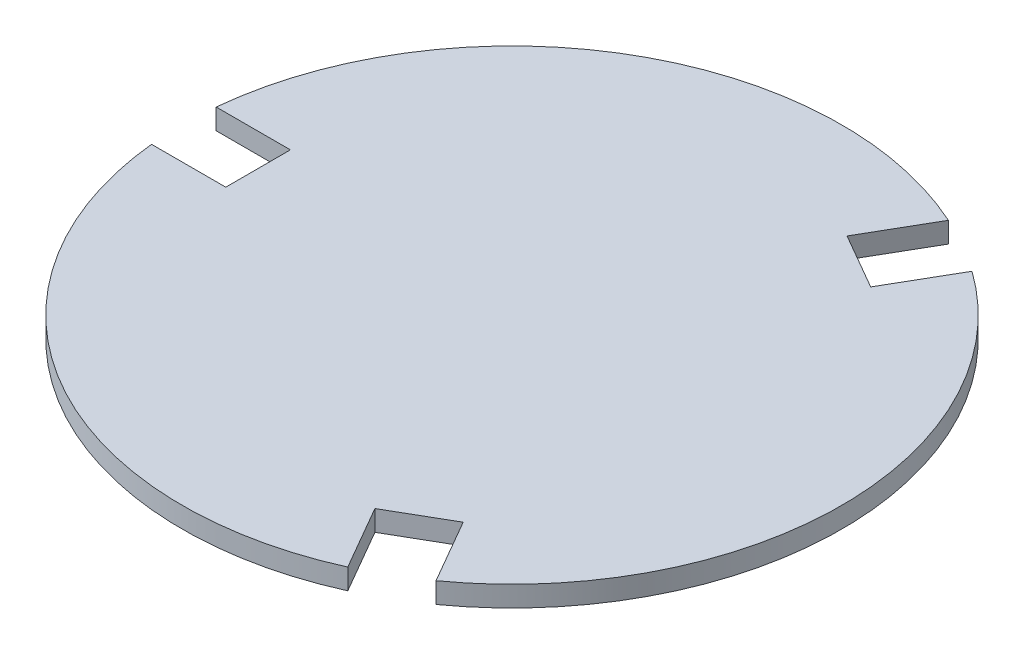
from build123d import *

# Parameters (mm, degrees)
SKETCH1_R         = 50.8
EXTRUDE1_DEPTH    = 3.175
EXTRUDE2_DEPTH    = 72.912172996
CIRPATTERN1_COUNT = 2
CIRPATTERN1_ANGLE = 120
CIRPATTERN2_COUNT = 2
CIRPATTERN2_ANGLE = 120


with BuildPart() as part:
    # Sketch1 → Extrude1 (new body)
    with BuildSketch(Plane(origin=(0, 0, 0), x_dir=(1, 0, 0), z_dir=(0, 1, 0))):
        with Locations(Location((0, 0, 0), (0, 0, 270))):
            Circle(SKETCH1_R)
    extrude(amount=EXTRUDE1_DEPTH)

    # Sketch3 → Extrude2 (cut, through all)
    with BuildSketch(Plane(origin=(0, 3.175, 0), x_dir=(-1, 0, 0), z_dir=(0, 1, 0))):
        Polygon((42.177913697, -4.9784), (39.125469867, -4.9784), (39.125469867, 4.9784), (42.300469867, 4.9784), (50.555469867, 4.9784), (52.750339101, 4.9784), (52.750339101, -4.9784), (50.555469867, -4.9784), align=None)
    extrude2 = extrude(amount=-EXTRUDE2_DEPTH, mode=Mode.SUBTRACT)

    # CirPattern1: Extrude2 ×2 about axis
    cirpattern1_axis = Axis((0, 38.178274824, 0), (0, -1, 0))
    for i in range(1, CIRPATTERN1_COUNT):
        add(extrude2.rotate(cirpattern1_axis, i * CIRPATTERN1_ANGLE / (CIRPATTERN1_COUNT - 1)), mode=Mode.SUBTRACT)

    # CirPattern2: Extrude2 ×2 about axis
    cirpattern2_axis = Axis((0, 0, 0), (0, 1, 0))
    for i in range(1, CIRPATTERN2_COUNT):
        add(extrude2.rotate(cirpattern2_axis, i * CIRPATTERN2_ANGLE / (CIRPATTERN2_COUNT - 1)), mode=Mode.SUBTRACT)


solid = part.part
